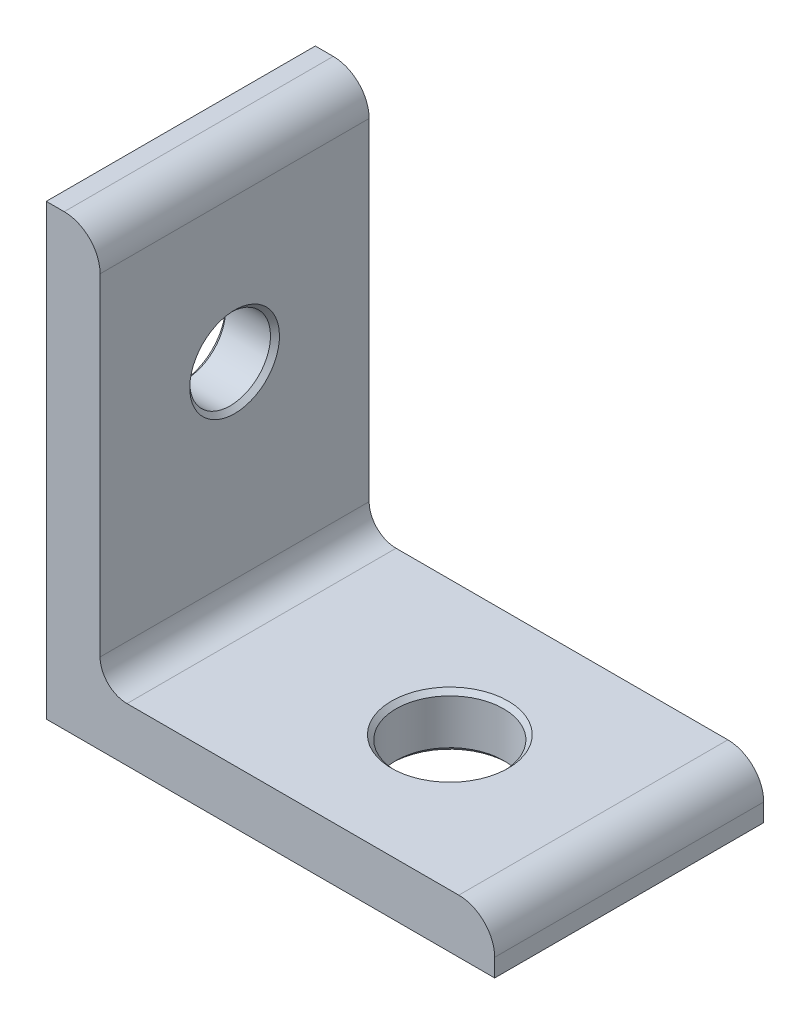
from build123d import *

# Parameters (mm, degrees)
ESQUISSE1_W                     = 50
ESQUISSE1_H                     = 50
BOSS_EXTRU_1_DEPTH              = 30
ESQUISSE2_W                     = 84
ESQUISSE2_H                     = 84
ENL_V_MAT_EXTRU_1_DEPTH         = 77.811457479
DIAM_TRE_DU_PER_AGE_12_0_12_1_D = 12
DIAM_TRE_DU_PER_AGE_9_0_9_2_D   = 9
CHANFREIN1_SIZE                 = 0.5
CONG_1_R                        = 3
CONG_2_R                        = 4.00000002


with BuildPart() as part:
    # Esquisse1 → Boss.-Extru.1 (new body)
    with BuildSketch(Plane.XY.offset(20.5)):
        with Locations((25, 25)):
            Rectangle(ESQUISSE1_W, ESQUISSE1_H)
    extrude(amount=-BOSS_EXTRU_1_DEPTH)

    # Esquisse2 → Enlèv. mat.-Extru.1 (cut, through all)
    with BuildSketch(Plane(origin=(0, 0, -9.5), x_dir=(-1, 0, 0), z_dir=(0, 0, -1))):
        with Locations((-48, 48)):
            Rectangle(ESQUISSE2_W, ESQUISSE2_H)
    extrude(amount=-ENL_V_MAT_EXTRU_1_DEPTH, mode=Mode.SUBTRACT)

    # Diamètre du perçage Ø12.0 (12)1 (through all)
    with Locations(Plane(origin=(0, 6, 0), x_dir=(1, 0, 0), z_dir=(0, 1, 0))):
        with Locations((30, -5.5)):
            Hole(DIAM_TRE_DU_PER_AGE_12_0_12_1_D / 2)

    # Diamètre du perçage Ø9.0 (9)2 (through all)
    with Locations(Plane(origin=(6, 0, 0), x_dir=(0, 0, -1), z_dir=(1, 0, 0))):
        with Locations((-5.5, 30)):
            Hole(DIAM_TRE_DU_PER_AGE_9_0_9_2_D / 2)

    # Chanfrein1
    chanfrein1_edges = [part.edges().sort_by_distance(p)[0] for p in [
        (36, 6, 5.5),
        (36, 0, 5.5),
        (6, 30, 1),
        (0, 30, 1),
    ]]
    chamfer(chanfrein1_edges, length=CHANFREIN1_SIZE)

    # Congé1
    cong_1_edges = [part.edges().sort_by_distance(p)[0] for p in [
        (6, 6, 5.5),
    ]]
    fillet(cong_1_edges, radius=CONG_1_R)

    # Congé2
    cong_2_edges = [part.edges().sort_by_distance(p)[0] for p in [
        (50, 6, 5.5),
        (6, 50, 5.5),
    ]]
    fillet(cong_2_edges, radius=CONG_2_R)


solid = part.part
